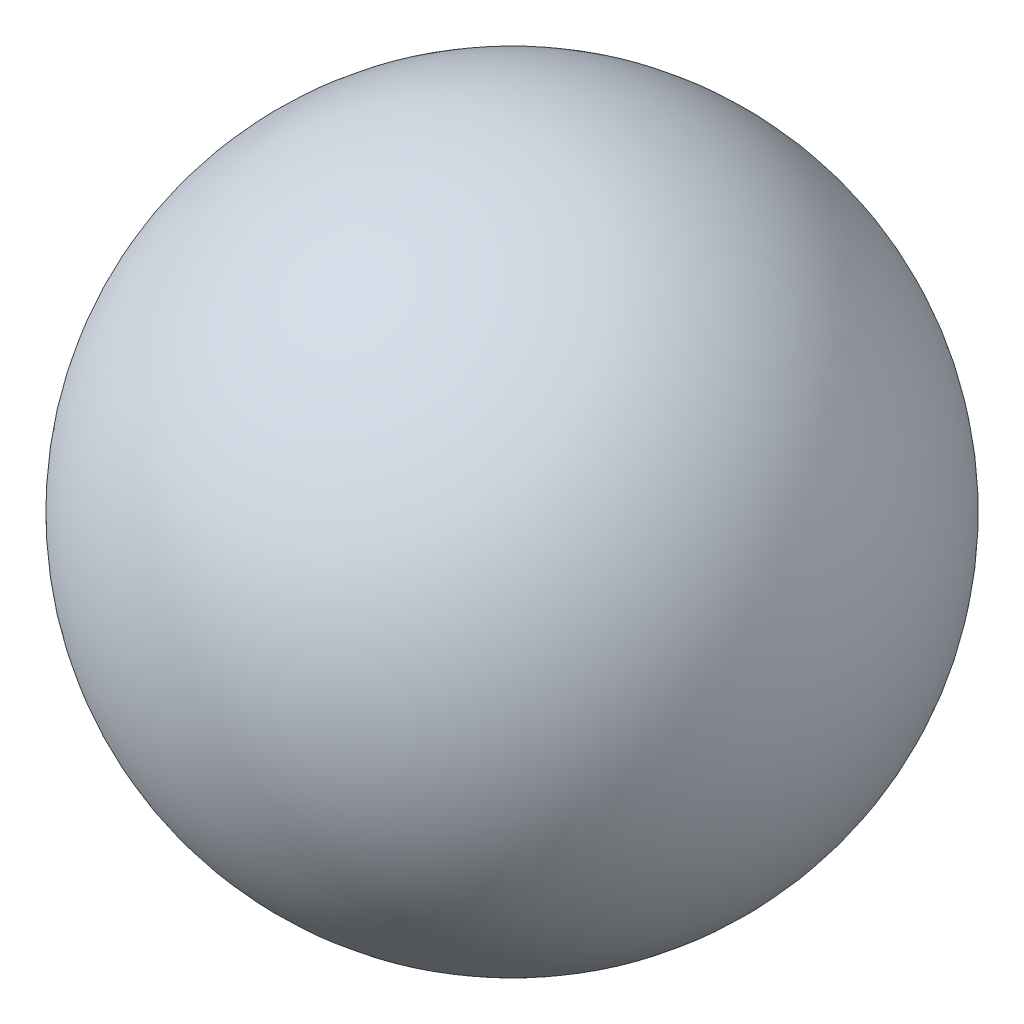
from build123d import *


with BuildPart() as part:
    # Sketch1 → Revolve1 (revolve)
    with BuildSketch(Plane.XY):
        with BuildLine():
            Line((0, 4), (0, 0))
            Line((0, 0), (0, -4))
            ThreePointArc((0, -4), (4, 0), (0, 4))
        make_face()
    revolve(axis=Axis((0, 0, 0), (0, -1, 0)))


solid = part.part
